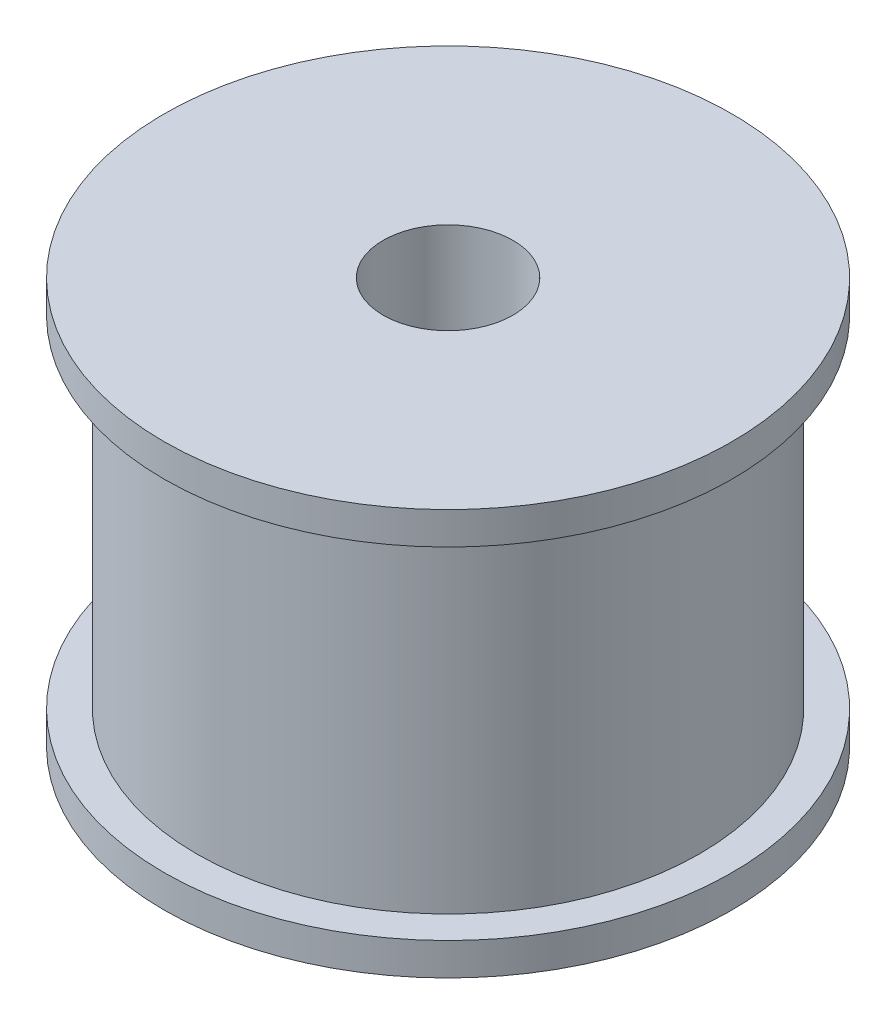
from build123d import *

# Parameters (mm, degrees)
SKETCH1_R           = 17.5
BOSS_EXTRUDE1_DEPTH = 2
SKETCH2_R           = 15.5
BOSS_EXTRUDE2_DEPTH = 21
SKETCH3_R           = 17.5
BOSS_EXTRUDE3_DEPTH = 2
SKETCH4_R           = 4
CUT_EXTRUDE1_DEPTH  = 36.178118199


with BuildPart() as part:
    # Sketch1 → Boss-Extrude1 (new body)
    with BuildSketch(Plane(origin=(0, 0, 0), x_dir=(1, 0, 0), z_dir=(0, 1, 0))):
        with Locations(Location((0, 0, 0), (0, 0, 270))):
            Circle(SKETCH1_R)
    extrude(amount=BOSS_EXTRUDE1_DEPTH)

    # Sketch2 → Boss-Extrude2 (add)
    with BuildSketch(Plane(origin=(0, 2, 0), x_dir=(1, 0, 0), z_dir=(0, 1, 0))):
        with Locations(Location((0, 0, 0), (0, 0, 90))):
            Circle(SKETCH2_R)
    extrude(amount=BOSS_EXTRUDE2_DEPTH)

    # Sketch3 → Boss-Extrude3 (add)
    with BuildSketch(Plane(origin=(0, 23, 0), x_dir=(1, 0, 0), z_dir=(0, 1, 0))):
        with Locations(Location((0, 0, 0), (0, 0, 270))):
            Circle(SKETCH3_R)
    extrude(amount=BOSS_EXTRUDE3_DEPTH)

    # Sketch4 → Cut-Extrude1 (cut, through all)
    with BuildSketch(Plane(origin=(0, 25, 0), x_dir=(1, 0, 0), z_dir=(0, 1, 0))):
        with Locations(Location((0, 0, 0), (0, 0, 270))):
            Circle(SKETCH4_R)
    extrude(amount=-CUT_EXTRUDE1_DEPTH, mode=Mode.SUBTRACT)


solid = part.part
